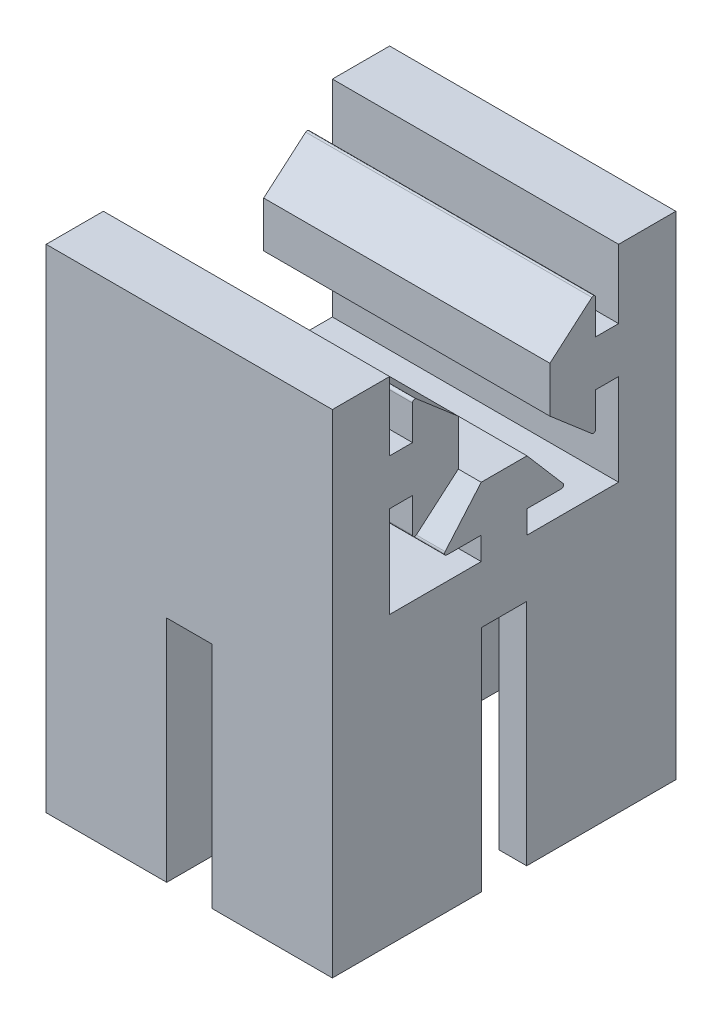
from build123d import *

# Parameters (mm, degrees)
SKETCH10_W          = 2.54
SKETCH10_H          = 5.08
SKETCH10_W_2        = 5.08
SKETCH10_H_2        = 2.54
BOSS_EXTRUDE3_DEPTH = 15.875
BOSS_EXTRUDE4_DEPTH = 31.75
SKETCH12_W          = 13.97
SKETCH12_H          = 7.62
CUT_EXTRUDE1_DEPTH  = 42.639734629
SKETCH14_W          = 31.75
SKETCH14_H          = 38.1
SKETCH14_W_2        = 25.6
SKETCH14_H_2        = 25.6
BOSS_EXTRUDE5_DEPTH = 25.4
CUT_EXTRUDE2_DEPTH  = 25.4


with BuildPart() as part:
    # Sketch10 → Boss-Extrude3 (new, symmetric)
    with BuildSketch(Plane(origin=(0, 0, 0), x_dir=(0, 0, -1), z_dir=(1, 0, 0))):
        with Locations((-11.43, 0)):
            Rectangle(SKETCH10_W, SKETCH10_H)
        with BuildLine():
            Line((-5.08, 2.54), (-9.740509205, 6.542688341))
            ThreePointArc((-9.740509205, 6.542688341), (-10.012022021, 6.580814495), (-10.16, 6.35))
            Line((-10.16, 6.35), (-10.16, -6.35))
            ThreePointArc((-10.16, -6.35), (-10.012022021, -6.580814495), (-9.740509205, -6.542688341))
            Line((-9.740509205, -6.542688341), (-5.08, -2.54))
            Line((-5.08, -2.54), (-5.08, 2.54))
        make_face()
        with BuildLine():
            Line((6.35, 10.16), (-6.35, 10.16))
            ThreePointArc((-6.35, 10.16), (-6.580814495, 10.012022021), (-6.542688341, 9.740509205))
            Line((-6.542688341, 9.740509205), (-2.54, 5.08))
            Line((-2.54, 5.08), (2.54, 5.08))
            Line((2.54, 5.08), (6.542688341, 9.740509205))
            ThreePointArc((6.542688341, 9.740509205), (6.580814495, 10.012022021), (6.35, 10.16))
        make_face()
        with Locations((0, 11.43)):
            Rectangle(SKETCH10_W_2, SKETCH10_H_2)
        with BuildLine():
            ThreePointArc((6.542688341, -9.740509205), (6.580814495, -10.012022021), (6.35, -10.16))
            Line((6.35, -10.16), (-6.35, -10.16))
            ThreePointArc((-6.35, -10.16), (-6.580814495, -10.012022021), (-6.542688341, -9.740509205))
            Line((-6.542688341, -9.740509205), (-2.54, -5.08))
            Line((-2.54, -5.08), (2.54, -5.08))
            Line((2.54, -5.08), (6.542688341, -9.740509205))
        make_face()
        with Locations((0, -11.43)):
            Rectangle(SKETCH10_W_2, SKETCH10_H_2)
        with BuildLine():
            Line((5.08, 2.54), (5.08, -2.54))
            Line((5.08, -2.54), (9.740509205, -6.542688341))
            ThreePointArc((9.740509205, -6.542688341), (10.012022021, -6.580814495), (10.16, -6.35))
            Line((10.16, -6.35), (10.16, -2.54))
            Line((10.16, -2.54), (10.16, 2.54))
            Line((10.16, 2.54), (10.16, 6.35))
            ThreePointArc((10.16, 6.35), (10.012022021, 6.580814495), (9.740509205, 6.542688341))
            Line((9.740509205, 6.542688341), (5.08, 2.54))
        make_face()
        with Locations((11.43, 0)):
            Rectangle(SKETCH10_W, SKETCH10_H)
    extrude(amount=BOSS_EXTRUDE3_DEPTH, both=True)

    # Sketch11 → Boss-Extrude4 (add)
    with BuildSketch(Plane(origin=(15.875, 0, 0), x_dir=(0, 0, -1), z_dir=(1, 0, 0))):
        Polygon((-12.7, -2.54), (-12.7, -12.7), (12.7, -12.7), (12.7, -2.54), (12.7, 2.54), (12.7, 10.16), (19.05, 10.16), (19.05, -19.05), (-19.05, -19.05), (-19.05, 10.16), (-12.7, 10.16), (-12.7, 2.54), align=None)
    extrude(amount=-BOSS_EXTRUDE4_DEPTH)

    # Sketch12 → Cut-Extrude1 (cut, through all)
    with BuildSketch(Plane(origin=(15.875, 0, 0), x_dir=(0, 0, -1), z_dir=(1, 0, 0))):
        with Locations((0, 8.89)):
            Rectangle(SKETCH12_W, SKETCH12_H)
    extrude(amount=-CUT_EXTRUDE1_DEPTH, mode=Mode.SUBTRACT)

    # Sketch14 → Boss-Extrude5 (add)
    with BuildSketch(Plane.XZ.offset(19.05)):
        Rectangle(SKETCH14_W, SKETCH14_H)
        Rectangle(SKETCH14_W_2, SKETCH14_H_2, mode=Mode.SUBTRACT)
    extrude(amount=BOSS_EXTRUDE5_DEPTH)

    # Sketch15 → Cut-Extrude2 (cut)
    with BuildSketch(Plane.XZ.offset(44.45)):
        Polygon((-15.875, -2.5), (-15.875, 2.5), (-2.5, 2.5), (-2.5, 19.05), (2.5, 19.05), (2.5, 2.5), (15.875, 2.5), (15.875, -2.5), (2.5, -2.5), (2.5, -19.05), (-2.5, -19.05), (-2.5, -2.5), align=None)
    extrude(amount=-CUT_EXTRUDE2_DEPTH, mode=Mode.SUBTRACT)


solid = part.part
